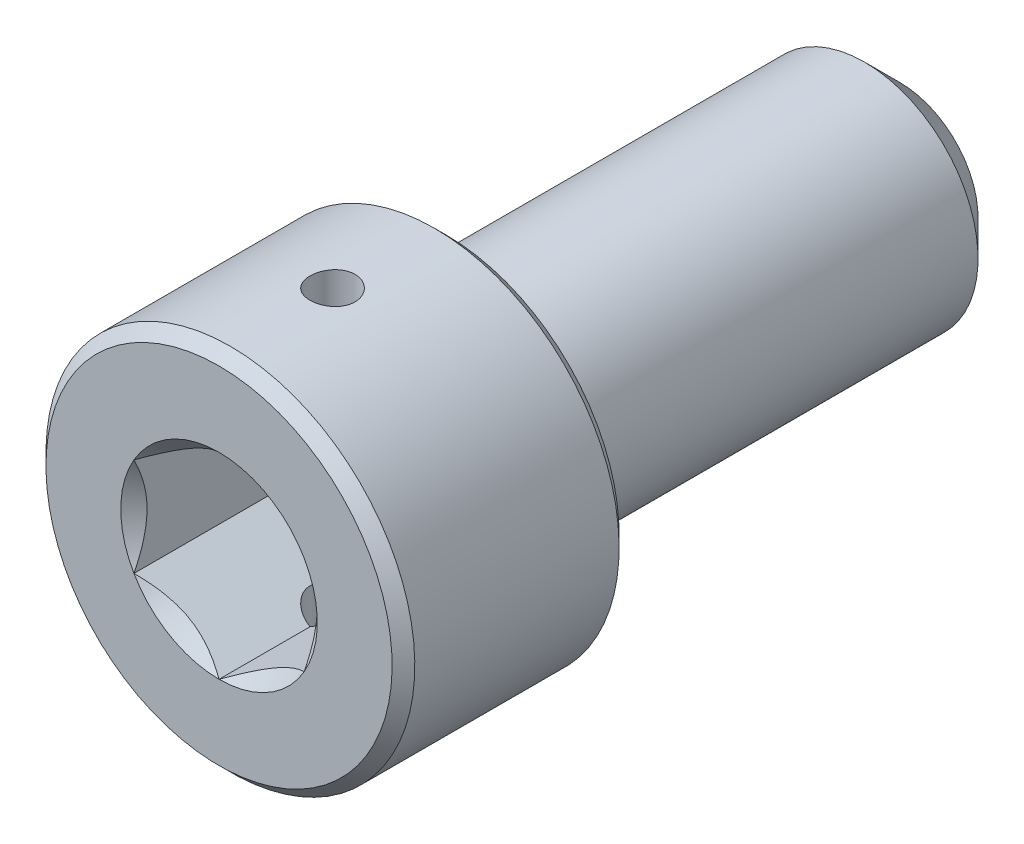
from build123d import *

# Parameters (mm, degrees)
CUT_EXTRUDE1_DEPTH      = 7
CUT_EXTRUDE3_DEPTH      = 7
CUT_EXTRUDE3_DEPTH_BACK = 7
SKETCH9_R               = 0.79375


with BuildPart() as part:
    # Sketch2 → Revolve1 (revolve)
    with BuildSketch(Plane(origin=(0, 0, 0), x_dir=(0, 0, -1), z_dir=(1, 0, 0))):
        Polygon((-12, 0), (-12, 6.1), (-11.6, 6.5), (-4.4, 6.5), (-4, 6.1), (-4, 4), (10.75, 4), (12, 2.75), (12, 0), align=None)
    revolve(axis=Axis((0, 0, -12), (0, 0, 1)))

    # Sketch3 → Cut-Extrude1 (cut)
    with BuildSketch(Plane.XY.offset(12)):
        Polygon((3, -1.732050808), (3, 1.732050808), (0, 3.464101615), (-3, 1.732050808), (-3, -1.732050808), (0, -3.464101615), align=None)
    extrude(amount=-CUT_EXTRUDE1_DEPTH, mode=Mode.SUBTRACT)

    # Cut-Extrude2 cone 1 section (through the dimple's axis) → Cut-Extrude2 (revolve, cut)
    with BuildSketch(Plane(origin=(0, 0, 12), x_dir=(0, -1, 0), z_dir=(1, 0, 0))):
        Polygon((0, 0), (3.464101615, 0), (0, 3.464101615), align=None)
    revolve(axis=Axis((0, 0, 12), (0, 0, -1)), mode=Mode.SUBTRACT)

    # Sketch9 → Cut-Extrude3 (cut, two sides: drawn at the far end of the back side and taken through both)
    with BuildSketch(Plane(origin=(0, 0, 0), x_dir=(1, 0, 0), z_dir=(0, 1, 0)).offset(-CUT_EXTRUDE3_DEPTH_BACK)):
        with Locations(Location((0, -8, 0), (0, 0, 90))):
            Circle(SKETCH9_R)
    extrude(amount=CUT_EXTRUDE3_DEPTH + CUT_EXTRUDE3_DEPTH_BACK, mode=Mode.SUBTRACT)


solid = part.part
